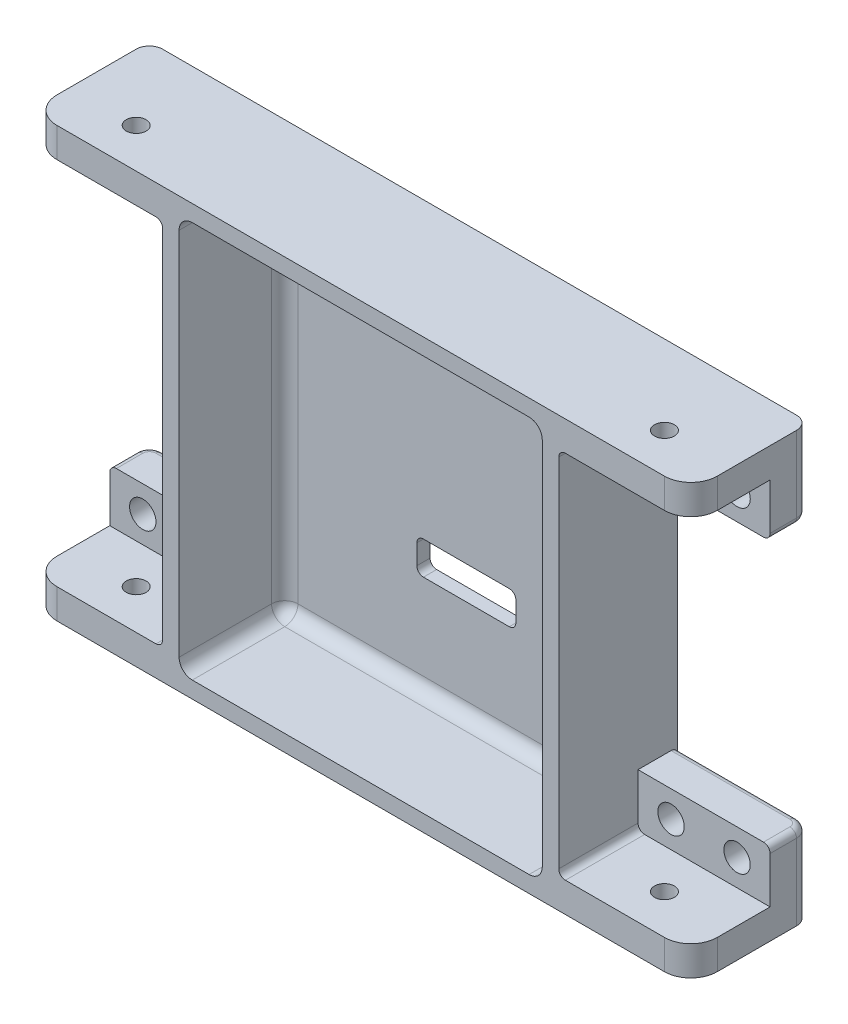
from build123d import *

# Parameters (mm, degrees)
SKETCH_1_W          = 100
SKETCH_1_H          = 65
EXTRUDE_1_DEPTH     = 18
SKETCH_2_W          = 55
SKETCH_2_H          = 60
CUT_EXTRUDE_1_DEPTH = 16
SKETCH_3_W          = 15
SKETCH_3_H          = 5
CUT_EXTRUDE_2_DEPTH = 62.743420702
SKETCH_4_W          = 20
SKETCH_4_H          = 56
CUT_EXTRUDE_3_DEPTH = 12
SKETCH_5_W          = 20
SKETCH_5_H          = 40
CUT_EXTRUDE_4_DEPTH = 61.829680256
SKETCH_6_R          = 2
CUT_EXTRUDE_5_DEPTH = 61.829680256
SKETCH_7_R          = 1.5
CUT_EXTRUDE_6_DEPTH = 84.958322994
FILLET_1_R          = 2
FILLET_2_R          = 1
FILLET_3_R          = 4
FILLET_4_R          = 2
FILLET_5_R          = 1


with BuildPart() as part:
    # 草图1 → 凸台-拉伸1 (new body)
    with BuildSketch(Plane.XY):
        Rectangle(SKETCH_1_W, SKETCH_1_H)
    extrude(amount=EXTRUDE_1_DEPTH)

    # 草图2 → 切除-拉伸1 (cut)
    with BuildSketch(Plane.XY.offset(18)):
        Rectangle(SKETCH_2_W, SKETCH_2_H)
    extrude(amount=-CUT_EXTRUDE_1_DEPTH, mode=Mode.SUBTRACT)

    # 草图3 → 切除-拉伸2 (cut, through all)
    with BuildSketch(Plane.XY.offset(2)):
        with Locations((0, -12.5)):
            Rectangle(SKETCH_3_W, SKETCH_3_H)
    extrude(amount=-CUT_EXTRUDE_2_DEPTH, mode=Mode.SUBTRACT)

    # 草图4 → 切除-拉伸3 (cut)
    with BuildSketch(Plane.XY.offset(18)):
        with Locations((40, 0)):
            Rectangle(SKETCH_4_W, SKETCH_4_H)
    cut_extrude_3 = extrude(amount=-CUT_EXTRUDE_3_DEPTH, mode=Mode.SUBTRACT)

    # 草图5 → 切除-拉伸4 (cut, through all)
    with BuildSketch(Plane.XY.offset(6)):
        with Locations((40, 0)):
            Rectangle(SKETCH_5_W, SKETCH_5_H)
    cut_extrude_4 = extrude(amount=-CUT_EXTRUDE_4_DEPTH, mode=Mode.SUBTRACT)

    # 草图6 → 切除-拉伸5 (cut, through all)
    with BuildSketch(Plane.XY.offset(6)):
        with Locations((45, 24)):
            Circle(SKETCH_6_R)
        with Locations((35, 24)):
            Circle(SKETCH_6_R)
        with Locations(Location((35, -24, 0), (0, 0, 180))):
            Circle(SKETCH_6_R)
        with Locations(Location((45, -24, 0), (0, 0, 180))):
            Circle(SKETCH_6_R)
    cut_extrude_5 = extrude(amount=-CUT_EXTRUDE_5_DEPTH, mode=Mode.SUBTRACT)

    # 草图7 → 切除-拉伸6 (cut, through all)
    with BuildSketch(Plane(origin=(0, 32.5, 0), x_dir=(1, 0, 0), z_dir=(0, 1, 0))):
        with Locations(Location((40, -12, 0), (0, 0, 270))):
            Circle(SKETCH_7_R)
    cut_extrude_6 = extrude(amount=-CUT_EXTRUDE_6_DEPTH, mode=Mode.SUBTRACT)

    # 镜向1: 切除-拉伸3, 切除-拉伸4, 切除-拉伸5, 切除-拉伸6 across plane
    add(cut_extrude_3.mirror(Plane(origin=(0, 0, 0), x_dir=(0, 0, 1), z_dir=(1, 0, 0))), mode=Mode.SUBTRACT)
    add(cut_extrude_4.mirror(Plane(origin=(0, 0, 0), x_dir=(0, 0, 1), z_dir=(1, 0, 0))), mode=Mode.SUBTRACT)
    add(cut_extrude_5.mirror(Plane(origin=(0, 0, 0), x_dir=(0, 0, 1), z_dir=(1, 0, 0))), mode=Mode.SUBTRACT)
    add(cut_extrude_6.mirror(Plane(origin=(0, 0, 0), x_dir=(0, 0, 1), z_dir=(1, 0, 0))), mode=Mode.SUBTRACT)

    # 圆角1
    fillet_1_edges = [part.edges().sort_by_distance(p)[0] for p in [
        (27.5, 0, 2),
        (27.5, 30, 10),
        (0, -30, 2),
        (27.5, -30, 10),
        (-27.5, 0, 2),
        (-27.5, -30, 10),
        (0, 30, 2),
        (-27.5, 30, 10),
    ]]
    fillet(fillet_1_edges, radius=FILLET_1_R)

    # 圆角2
    fillet_2_edges = [part.edges().sort_by_distance(p)[0] for p in [
        (7.5, -10, 1),
        (7.5, -15, 1),
        (-7.5, -15, 1),
        (-7.5, -10, 1),
    ]]
    fillet(fillet_2_edges, radius=FILLET_2_R)

    # 圆角3
    fillet_3_edges = [part.edges().sort_by_distance(p)[0] for p in [
        (-50, 30.25, 18),
        (50, -30.25, 18),
        (50, 30.25, 18),
        (-50, -30.25, 18),
    ]]
    fillet(fillet_3_edges, radius=FILLET_3_R)

    # 圆角4
    fillet_4_edges = [part.edges().sort_by_distance(p)[0] for p in [
        (-50, -26.25, 0),
        (-50, 26.25, 0),
        (50, -26.25, 0),
        (50, 26.25, 0),
    ]]
    fillet(fillet_4_edges, radius=FILLET_4_R)

    # 圆角5
    fillet_5_edges = [part.edges().sort_by_distance(p)[0] for p in [
        (-30, 28, 12),
        (-30, -28, 12),
        (-39, -20, 0),
        (-50, 20, 4),
        (-39, 20, 0),
        (-49.414213562, 20, 0.585786438),
        (39, 20, 0),
        (-50, -20, 4),
        (-49.414213562, -20, 0.585786438),
        (50, -20, 4),
        (49.414213562, -20, 0.585786438),
        (50, 20, 4),
        (49.414213562, 20, 0.585786438),
        (30, 28, 12),
        (30, -28, 12),
        (39, -20, 0),
    ]]
    fillet(fillet_5_edges, radius=FILLET_5_R)


solid = part.part
